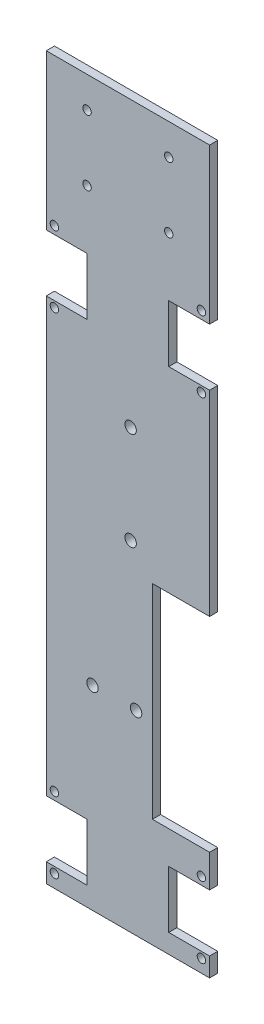
from build123d import *

# Parameters (mm, degrees)
EXTRUDE_1_DEPTH     = 3
SKETCH_4_W          = 15
SKETCH_4_H          = 21
CUT_EXTRUDE_1_DEPTH = 3
SKETCH_5_R          = 1.55
CUT_EXTRUDE_2_DEPTH = 272.724124803
SKETCH_7_W          = 21
SKETCH_7_H          = 75
CUT_EXTRUDE_3_DEPTH = 272.724124803
SKETCH_8_R          = 2.1
CUT_EXTRUDE_4_DEPTH = 272.724124803
SKETCH_9_R          = 2.1
CUT_EXTRUDE_5_DEPTH = 272.724124803


with BuildPart() as part:
    # 草图1 → 凸台-拉伸1 (new body)
    with BuildSketch(Plane.XY):
        Polygon((0, 240), (0, 265), (60, 265), (60, 240), (60, 0), (0, 0), align=None)
    extrude(amount=EXTRUDE_1_DEPTH)

    # 草图4 → 切除-拉伸1 (cut)
    with BuildSketch(Plane(origin=(0, 0, 0), x_dir=(-1, 0, 0), z_dir=(0, 0, -1))):
        with Locations((-52.5, 17.5)):
            Rectangle(SKETCH_4_W, SKETCH_4_H)
        with Locations((-7.5, 17.5)):
            Rectangle(SKETCH_4_W, SKETCH_4_H)
        with Locations((-7.5, 197.5)):
            Rectangle(SKETCH_4_W, SKETCH_4_H)
        with Locations((-52.5, 197.5)):
            Rectangle(SKETCH_4_W, SKETCH_4_H)
    extrude(amount=-CUT_EXTRUDE_1_DEPTH, mode=Mode.SUBTRACT)

    # 草图5 → 切除-拉伸2 (cut, through all)
    with BuildSketch(Plane(origin=(0, 0, 0), x_dir=(-1, 0, 0), z_dir=(0, 0, -1))):
        with Locations((-45, 229.6)):
            Circle(SKETCH_5_R)
        with Locations((-45, 253.6)):
            Circle(SKETCH_5_R)
        with Locations((-15, 253.6)):
            Circle(SKETCH_5_R)
        with Locations((-15, 229.6)):
            Circle(SKETCH_5_R)
        with Locations((-57, 184.75)):
            Circle(SKETCH_5_R)
        with Locations((-3, 184.75)):
            Circle(SKETCH_5_R)
        with Locations((-3, 210.85)):
            Circle(SKETCH_5_R)
        with Locations((-57, 210.85)):
            Circle(SKETCH_5_R)
        with Locations((-57, 4.75)):
            Circle(SKETCH_5_R)
        with Locations((-3, 4.75)):
            Circle(SKETCH_5_R)
        with Locations((-3, 30.85)):
            Circle(SKETCH_5_R)
        with Locations((-57, 30.85)):
            Circle(SKETCH_5_R)
    extrude(amount=-CUT_EXTRUDE_2_DEPTH, mode=Mode.SUBTRACT)

    # 草图7 → 切除-拉伸3 (cut, through all)
    with BuildSketch(Plane(origin=(0, 0, 0), x_dir=(-1, 0, 0), z_dir=(0, 0, -1))):
        with Locations((-49.5, 77.5)):
            Rectangle(SKETCH_7_W, SKETCH_7_H)
    extrude(amount=-CUT_EXTRUDE_3_DEPTH, mode=Mode.SUBTRACT)

    # 草图8 → 切除-拉伸4 (cut, through all)
    with BuildSketch(Plane.XY.offset(3)):
        with Locations((31, 160.7)):
            Circle(SKETCH_8_R)
        with Locations((31, 124.7)):
            Circle(SKETCH_8_R)
    extrude(amount=-CUT_EXTRUDE_4_DEPTH, mode=Mode.SUBTRACT)

    # 草图9 → 切除-拉伸5 (cut, through all)
    with BuildSketch(Plane(origin=(0, 0, 0), x_dir=(-1, 0, 0), z_dir=(0, 0, -1))):
        with Locations((-17, 71.6)):
            Circle(SKETCH_9_R)
        with Locations((-33, 71.6)):
            Circle(SKETCH_9_R)
    extrude(amount=-CUT_EXTRUDE_5_DEPTH, mode=Mode.SUBTRACT)


solid = part.part
